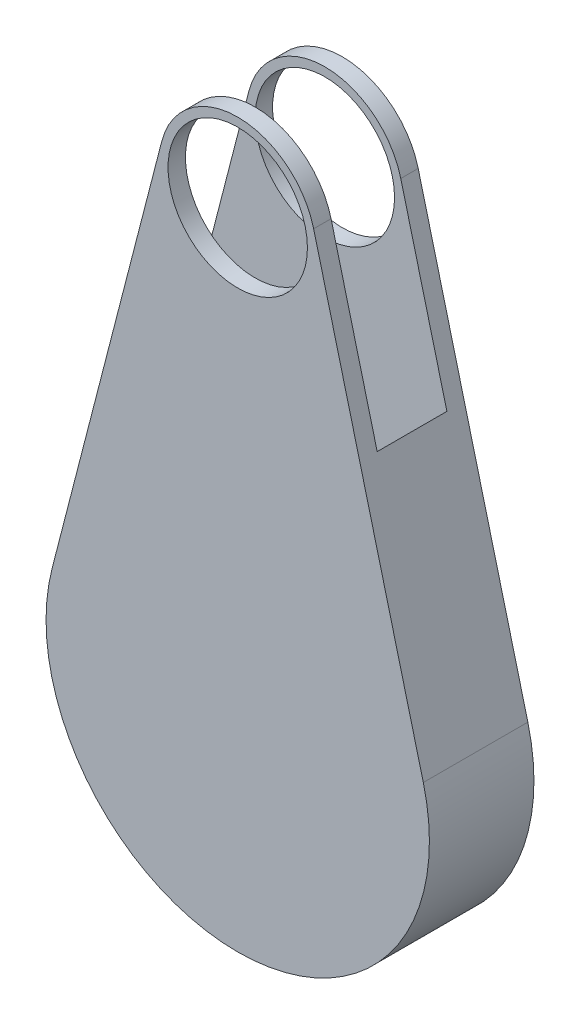
from build123d import *

# Parameters (mm, degrees)
BOSS_EXTRUDE1_DEPTH = 15
SKETCH2_R           = 20
CUT_EXTRUDE1_DEPTH  = 45
CUT_EXTRUDE2_DEPTH  = 10


with BuildPart() as part:
    # Sketch1 → Boss-Extrude1 (new, symmetric)
    with BuildSketch(Plane.XY):
        with BuildLine():
            Line((-53.25352101, 13.75), (-21.785531322, 135.625))
            ThreePointArc((-21.785531322, 135.625), (0, 152.5), (21.785531322, 135.625))
            Line((21.785531322, 135.625), (53.25352101, 13.75))
            ThreePointArc((53.25352101, 13.75), (0, -55), (-53.25352101, 13.75))
        make_face()
    extrude(amount=BOSS_EXTRUDE1_DEPTH, both=True)

    # Sketch2 → Cut-Extrude1 (cut)
    with BuildSketch(Plane.XY.offset(15)):
        with Locations((0, 130)):
            Circle(SKETCH2_R)
    extrude(amount=-CUT_EXTRUDE1_DEPTH, mode=Mode.SUBTRACT)

    # Sketch4 → Cut-Extrude2 (cut, symmetric)
    with BuildSketch(Plane.XY):
        with BuildLine():
            Line((-21.785531322, 135.625), (-35.020174222, 84.367448459))
            ThreePointArc((-35.020174222, 84.367448459), (0, 53.836754328), (35.020174222, 84.367448459))
            Line((35.020174222, 84.367448459), (21.785531322, 135.625))
            ThreePointArc((21.785531322, 135.625), (0, 152.5), (-21.785531322, 135.625))
        make_face()
    extrude(amount=CUT_EXTRUDE2_DEPTH, both=True, mode=Mode.SUBTRACT)


solid = part.part
